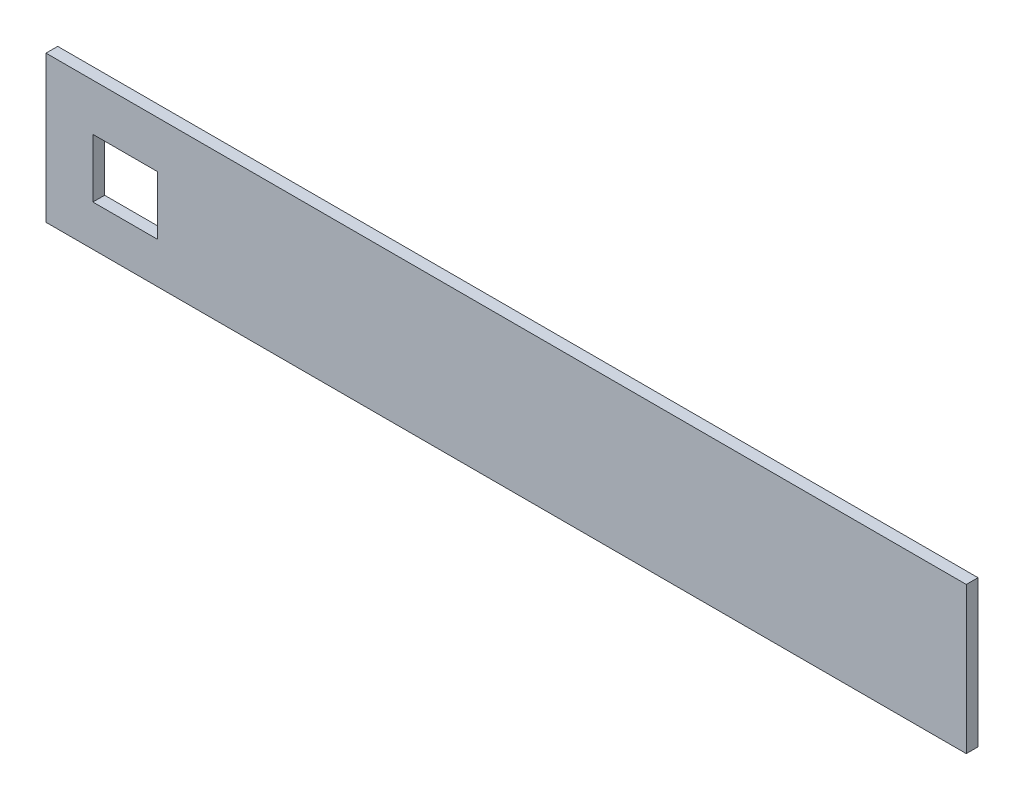
from build123d import *

# Parameters (mm, degrees)
SKETCH1_W           = 157
SKETCH1_H           = 25
BOSS_EXTRUDE1_DEPTH = 2
SKETCH2_W           = 11
SKETCH2_H           = 10
CUT_EXTRUDE1_DEPTH  = 80.514149684


with BuildPart() as part:
    # Sketch1 → Boss-Extrude1 (new body)
    with BuildSketch(Plane.XY):
        Rectangle(SKETCH1_W, SKETCH1_H)
    extrude(amount=BOSS_EXTRUDE1_DEPTH)

    # Sketch2 → Cut-Extrude1 (cut, through all)
    with BuildSketch(Plane.XY.offset(2)):
        with Locations((-65, -0.5)):
            Rectangle(SKETCH2_W, SKETCH2_H)
    extrude(amount=-CUT_EXTRUDE1_DEPTH, mode=Mode.SUBTRACT)


solid = part.part
